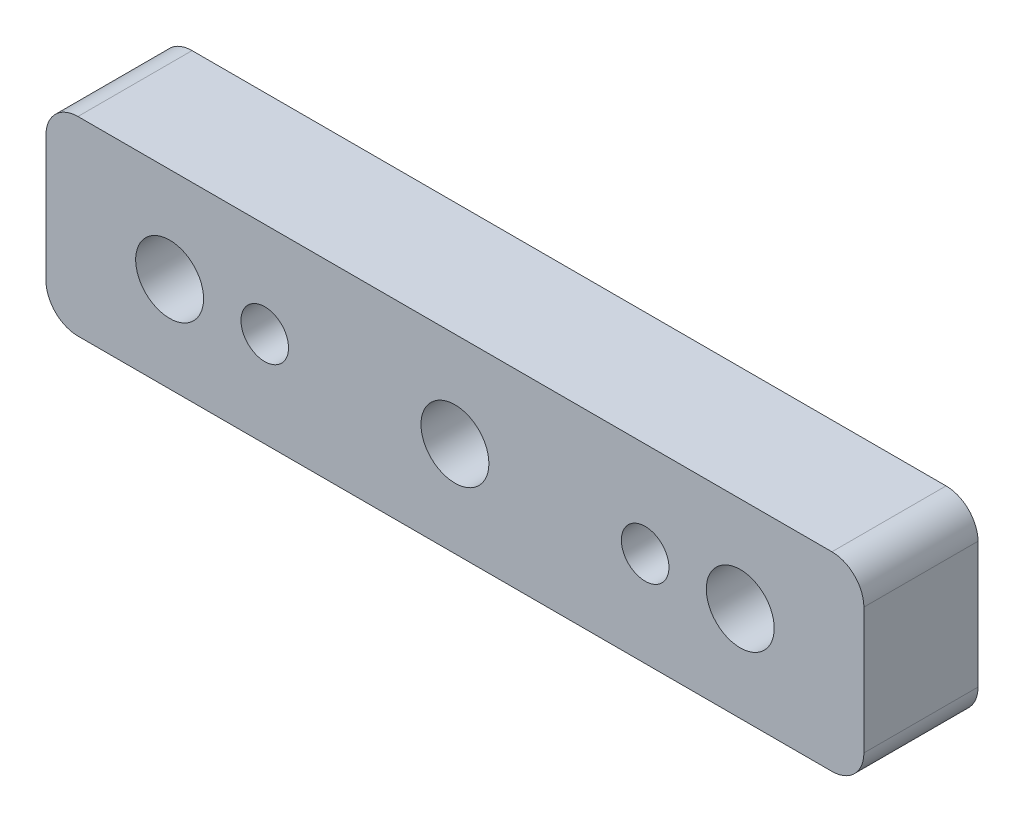
from build123d import *

# Parameters (mm, degrees)
ESQUISSE1_R        = 3.57
ESQUISSE1_R_2      = 2.5
BOSS_EXTRU_1_DEPTH = 6


with BuildPart() as part:
    # Esquisse1 → Boss.-Extru.1 (new, symmetric)
    with BuildSketch(Plane.XY):
        with BuildLine():
            Line((-39.64, -10), (39.64, -10))
            ThreePointArc((39.64, -10), (42.015878785, -9.015878785), (43, -6.64))
            Line((43, -6.64), (43, 6.64))
            ThreePointArc((43, 6.64), (42.015878785, 9.015878785), (39.64, 10))
            Line((39.64, 10), (-39.64, 10))
            ThreePointArc((-39.64, 10), (-42.015878785, 9.015878785), (-43, 6.64))
            Line((-43, 6.64), (-43, -6.64))
            ThreePointArc((-43, -6.64), (-42.015878785, -9.015878785), (-39.64, -10))
        make_face()
        with Locations((-30, 0)):
            Circle(ESQUISSE1_R, mode=Mode.SUBTRACT)
        Circle(ESQUISSE1_R, mode=Mode.SUBTRACT)
        with Locations((30, 0)):
            Circle(ESQUISSE1_R, mode=Mode.SUBTRACT)
        with Locations((-20, 0)):
            Circle(ESQUISSE1_R_2, mode=Mode.SUBTRACT)
        with Locations((20, 0)):
            Circle(ESQUISSE1_R_2, mode=Mode.SUBTRACT)
    extrude(amount=BOSS_EXTRU_1_DEPTH, both=True)


solid = part.part
